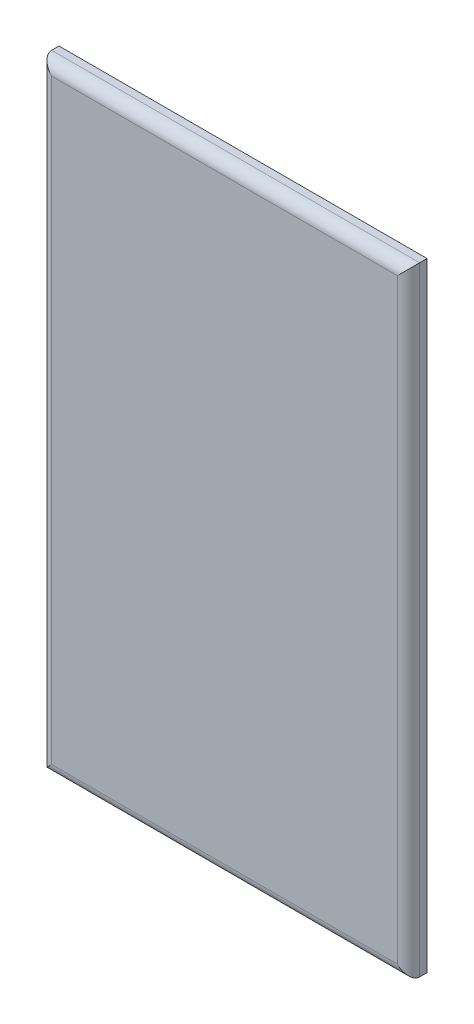
from build123d import *

# Parameters (mm, degrees)
ESBO_O1_W                = 99.1
ESBO_O1_H                = 166.52
RESSALTO_EXTRUS_O1_DEPTH = 5
FILETE1_R                = 3
ESBO_O2_R                = 3.1
CORTE_EXTRUS_O1_DEPTH    = 1.6
ESBO_O3_R                = 3.1
CORTE_EXTRUS_O2_DEPTH    = 1.6
ESBO_O4_R                = 3.1
CORTE_EXTRUS_O3_DEPTH    = 1.6
ESBO_O5_R                = 3.1
CORTE_EXTRUS_O4_DEPTH    = 1.6


with BuildPart() as part:
    # Esboço1 → Ressalto-extrusão1 (new body)
    with BuildSketch(Plane.XY):
        with Locations((5.497464185, 11.397762804)):
            Rectangle(ESBO_O1_W, ESBO_O1_H)
    extrude(amount=RESSALTO_EXTRUS_O1_DEPTH)

    # Filete1
    filete1_edges = [part.edges().sort_by_distance(p)[0] for p in [
        (55.047464185, 11.397762804, 5),
        (5.497464185, 94.657762804, 5),
        (-44.052535815, 11.397762804, 5),
        (5.497464185, -71.862237196, 5),
    ]]
    fillet(filete1_edges, radius=FILETE1_R)

    # Esboço2 → Corte-extrusão1 (cut)
    with BuildSketch(Plane(origin=(0, 0, 0), x_dir=(-1, 0, 0), z_dir=(0, 0, -1))):
        with Locations((-51.497464185, 91.107762804)):
            Circle(ESBO_O2_R)
    extrude(amount=-CORTE_EXTRUS_O1_DEPTH, mode=Mode.SUBTRACT)

    # Esboço3 → Corte-extrusão2 (cut)
    with BuildSketch(Plane(origin=(0, 0, 0), x_dir=(-1, 0, 0), z_dir=(0, 0, -1))):
        with Locations((40.502535815, 91.107762804)):
            Circle(ESBO_O3_R)
    extrude(amount=-CORTE_EXTRUS_O2_DEPTH, mode=Mode.SUBTRACT)

    # Esboço4 → Corte-extrusão3 (cut)
    with BuildSketch(Plane(origin=(0, 0, 0), x_dir=(-1, 0, 0), z_dir=(0, 0, -1))):
        with Locations((-51.497464185, -68.312237196)):
            Circle(ESBO_O4_R)
    extrude(amount=-CORTE_EXTRUS_O3_DEPTH, mode=Mode.SUBTRACT)

    # Esboço5 → Corte-extrusão4 (cut)
    with BuildSketch(Plane(origin=(0, 0, 0), x_dir=(-1, 0, 0), z_dir=(0, 0, -1))):
        with Locations((40.502535815, -68.312237196)):
            Circle(ESBO_O5_R)
    extrude(amount=-CORTE_EXTRUS_O4_DEPTH, mode=Mode.SUBTRACT)


solid = part.part
